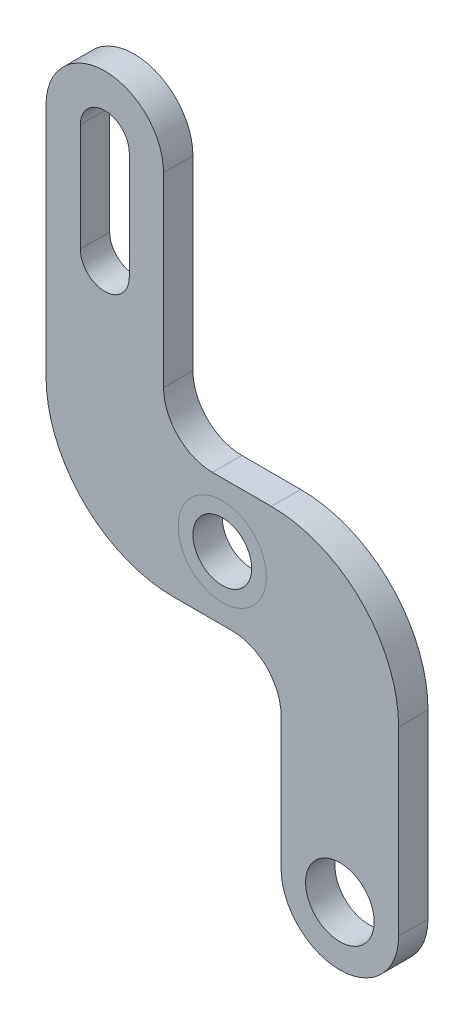
from build123d import *

# Parameters (mm, degrees)
SKETCH1_R           = 4.5
SKETCH1_R_2         = 3.5
BOSS_EXTRUDE1_DEPTH = 1.5
SKETCH1_4_R         = 4.5
SKETCH1_4_R_2       = 3
BOSS_EXTRUDE2_DEPTH = 1.5


with BuildPart() as part:
    # Sketch1 → Boss-Extrude1 (new, symmetric)
    with BuildSketch(Plane.XY):
        with BuildLine():
            Line((5, 6.5), (-1, 6.5))
            ThreePointArc((-1, 6.5), (-4.535533906, 7.964466094), (-6, 11.5))
            Line((-6, 11.5), (-6, 30.5))
            ThreePointArc((-6, 30.5), (-12, 36.5), (-18, 30.5))
            Line((-18, 30.5), (-18, 6.5))
            ThreePointArc((-18, 6.5), (-14.192388155, -2.692388155), (-5, -6.5))
            Line((-5, -6.5), (1, -6.5))
            ThreePointArc((1, -6.5), (4.535533906, -7.964466094), (6, -11.5))
            Line((6, -11.5), (6, -25))
            ThreePointArc((6, -25), (12, -31), (18, -25))
            Line((18, -25), (18, -6.5))
            ThreePointArc((18, -6.5), (14.192388155, 2.692388155), (5, 6.5))
        make_face()
        Circle(SKETCH1_R, mode=Mode.SUBTRACT)
        with Locations((12, -25)):
            Circle(SKETCH1_R_2, mode=Mode.SUBTRACT)
        with BuildLine():
            ThreePointArc((-14.5, 30.5), (-12, 33), (-9.5, 30.5))
            Line((-9.5, 30.5), (-9.5, 19.5))
            ThreePointArc((-9.5, 19.5), (-12, 17), (-14.5, 19.5))
            Line((-14.5, 19.5), (-14.5, 30.5))
        make_face(mode=Mode.SUBTRACT)
    extrude(amount=BOSS_EXTRUDE1_DEPTH, both=True)


with BuildPart() as body_2:
    # Sketch1<4> → Boss-Extrude2 (new, symmetric)
    with BuildSketch(Plane.XY):
        Circle(SKETCH1_4_R)
        Circle(SKETCH1_4_R_2, mode=Mode.SUBTRACT)
    extrude(amount=BOSS_EXTRUDE2_DEPTH, both=True)


solid = Compound([part.part, body_2.part])
